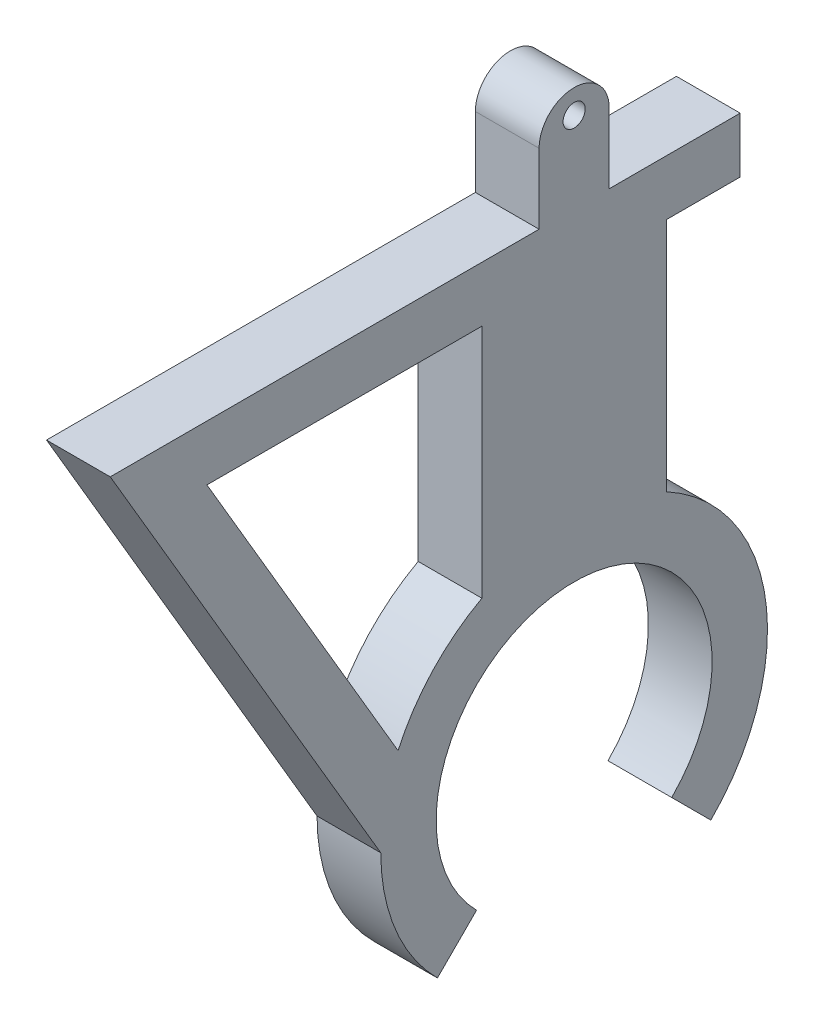
from build123d import *

# Parameters (mm, degrees)
SKETCH1_R           = 0.3
SKETCH1_W           = 2
SKETCH1_H           = 1.5
BOSS_EXTRUDE1_DEPTH = 1.7272


with BuildPart() as part:
    # Sketch1 → Boss-Extrude1 (new body)
    # profile 1 of 3: a face of its own
    with BuildSketch(Plane(origin=(0, 0, 0), x_dir=(0, 0, -1), z_dir=(1, 0, 0))):
        with BuildLine():
            ThreePointArc((-0.95, 14.390683939), (0, 15.340683939), (0.95, 14.390683939))
            Line((0.95, 14.390683939), (0.95, 12.490683939))
            Line((0.95, 12.490683939), (2.5, 12.490683939))
            Line((2.5, 12.490683939), (2.5, 4.605171007))
            ThreePointArc((2.5, 4.605171007), (5.185747801, 0.752076956), (3.705239533, -3.705239533))
            Line((3.705239533, -3.705239533), (2.644579362, -2.644579362))
            ThreePointArc((2.644579362, -2.644579362), (0, 3.74), (-2.644579362, -2.644579362))
            Line((-2.644579362, -2.644579362), (-3.705239533, -3.705239533))
            ThreePointArc((-3.705239533, -3.705239533), (-5.185747801, 0.752076956), (-2.5, 4.605171007))
            Line((-2.5, 4.605171007), (-2.5, 12.490683939))
            Line((-2.5, 12.490683939), (-0.95, 12.490683939))
            Line((-0.95, 12.490683939), (-0.95, 14.390683939))
        make_face()
        with Locations((0, 14.690683939)):
            Circle(SKETCH1_R, mode=Mode.SUBTRACT)
    # profile 2 of 3: a face of its own
    with BuildSketch(Plane(origin=(0, 0, 0), x_dir=(0, 0, -1), z_dir=(1, 0, 0))):
        with BuildLine():
            Line((-12.571622028, 12.490683939), (-5.24, 0))
            ThreePointArc((-5.24, 0), (-5.121580996, 1.107703977), (-4.771676297, 2.165341847))
            Line((-4.771676297, 2.165341847), (-9.951862811, 10.990683939))
            Line((-9.951862811, 10.990683939), (-2.5, 10.990683939))
            Line((-2.5, 10.990683939), (-2.5, 12.490683939))
            Line((-2.5, 12.490683939), (-12.571622028, 12.490683939))
        make_face()
    # profile 3 of 3: a face of its own
    with BuildSketch(Plane(origin=(0, 0, 0), x_dir=(0, 0, -1), z_dir=(1, 0, 0))):
        with Locations((3.5, 11.740683939)):
            Rectangle(SKETCH1_W, SKETCH1_H)
    extrude(amount=BOSS_EXTRUDE1_DEPTH)


solid = part.part
